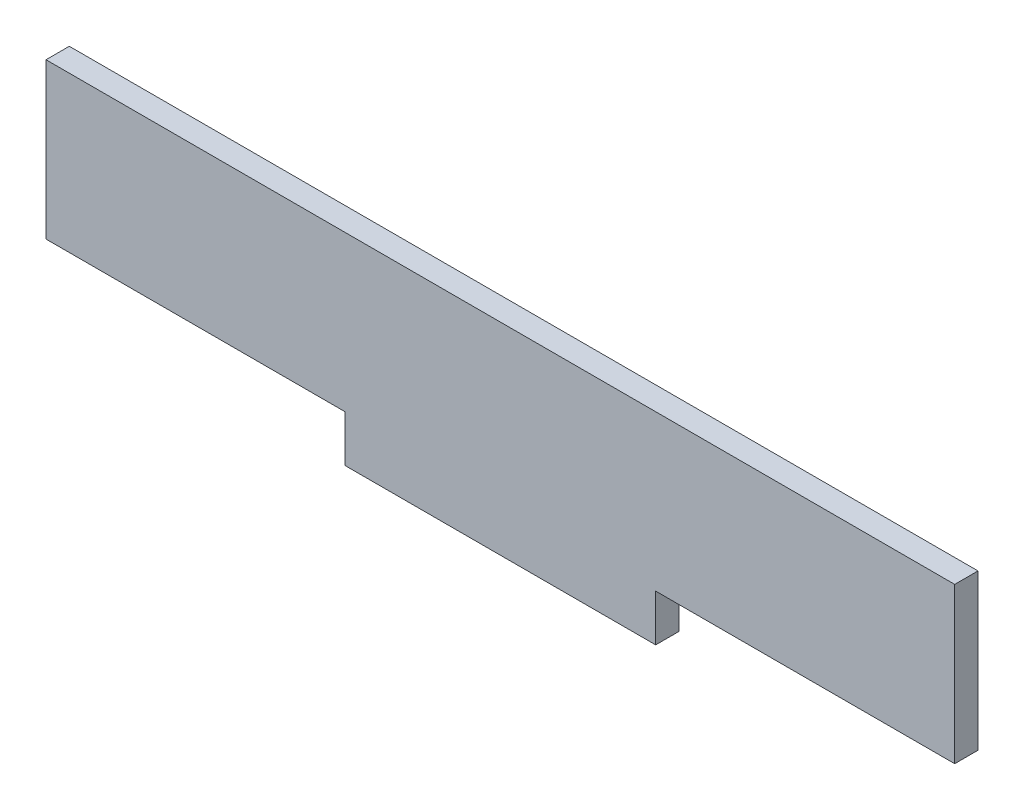
from build123d import *

# Parameters (mm, degrees)
BOSS_EXTRUDE1_DEPTH = 3


with BuildPart() as part:
    # Sketch1 → Boss-Extrude1 (new body)
    with BuildSketch(Plane.XY):
        Polygon((0, 0), (38.5, 0), (38.5, -6), (78.5, -6), (78.5, 0), (117, 0), (117, 20), (0, 20), align=None)
    extrude(amount=BOSS_EXTRUDE1_DEPTH)


solid = part.part
